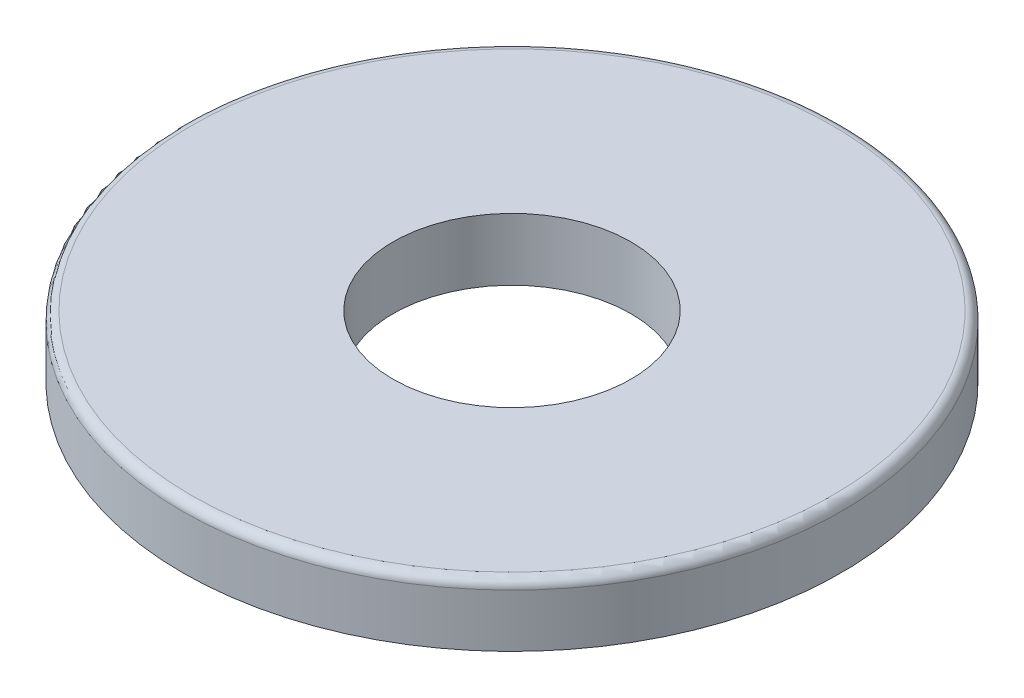
from build123d import *

# Parameters (mm, degrees)
SKETCH_1_R      = 9
SKETCH_1_R_2    = 3.25
EXTRUDE_1_DEPTH = 1.7
FILLET_1_R      = 0.25


with BuildPart() as part:
    # Эскиз1 → Вытянуть1 (new body)
    with BuildSketch(Plane(origin=(0, 0, 0), x_dir=(1, 0, 0), z_dir=(0, 1, 0))):
        with Locations(Location((0, 0, 0), (0, 0, 270))):
            Circle(SKETCH_1_R)
        with Locations(Location((0, 0, 0), (0, 0, 270))):
            Circle(SKETCH_1_R_2, mode=Mode.SUBTRACT)
    extrude(amount=EXTRUDE_1_DEPTH)

    # Скругление1
    fillet_1_edges = [part.edges().sort_by_distance(p)[0] for p in [
        (0, 1.7, -9),
    ]]
    fillet(fillet_1_edges, radius=FILLET_1_R)


solid = part.part
